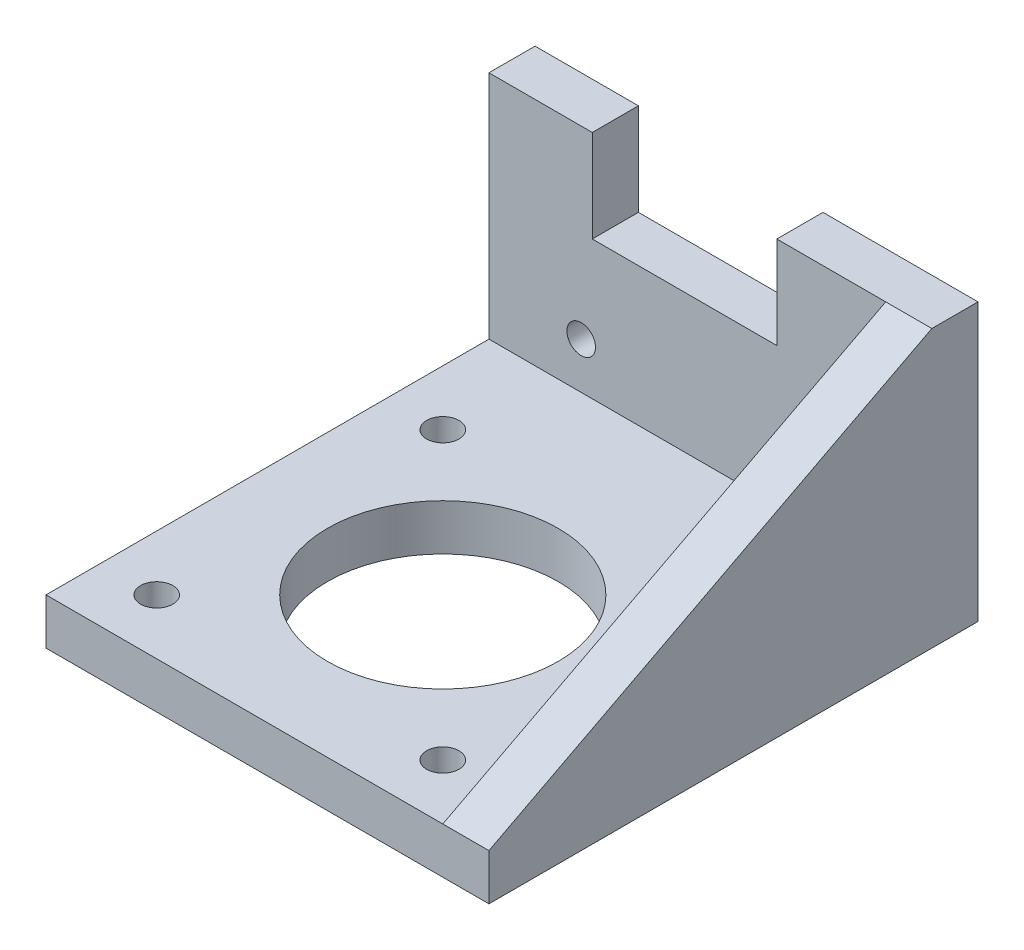
from build123d import *

# Parameters (mm, degrees)
SKETCH_1_W          = 43
SKETCH_1_H          = 43
SKETCH_1_R          = 1.75
SKETCH_1_R_2        = 12.5
EXTRUDE_1_DEPTH     = 5
SKETCH_3_W          = 43
SKETCH_3_H          = 5
EXTRUDE_2_DEPTH     = 5
SKETCH_4_W          = 43
SKETCH_4_H          = 30
EXTRUDE_3_DEPTH     = 5
SKETCH_5_R          = 1.55
CUT_EXTRUDE_1_DEPTH = 68.028261499
EXTRUDE_4_DEPTH     = 5
SKETCH_7_W          = 20
SKETCH_7_H          = 5
CUT_EXTRUDE_2_DEPTH = 10


with BuildPart() as part:
    # 草图1 → 凸台-拉伸1 (new body)
    with BuildSketch(Plane(origin=(0, 0, 0), x_dir=(1, 0, 0), z_dir=(0, 1, 0))):
        with Locations((-14.399691358, 11.712191358)):
            Rectangle(SKETCH_1_W, SKETCH_1_H)
        with Locations(Location((1.100308642, 27.212191358, 0), (0, 0, 270))):
            Circle(SKETCH_1_R, mode=Mode.SUBTRACT)
        with Locations(Location((-29.899691358, 27.212191358, 0), (0, 0, 270))):
            Circle(SKETCH_1_R, mode=Mode.SUBTRACT)
        with Locations(Location((-29.899691358, -3.787808642, 0), (0, 0, 270))):
            Circle(SKETCH_1_R, mode=Mode.SUBTRACT)
        with Locations(Location((1.100308642, -3.787808642, 0), (0, 0, 270))):
            Circle(SKETCH_1_R, mode=Mode.SUBTRACT)
        with Locations(Location((-14.399691358, 11.712191358, 0), (0, 0, 270))):
            Circle(SKETCH_1_R_2, mode=Mode.SUBTRACT)
    extrude(amount=EXTRUDE_1_DEPTH)

    # 草图3 → 凸台-拉伸2 (add)
    with BuildSketch(Plane(origin=(0, 0, -33.212191358), x_dir=(-1, 0, 0), z_dir=(0, 0, -1))):
        with Locations((14.399691358, 2.5)):
            Rectangle(SKETCH_3_W, SKETCH_3_H)
    extrude(amount=EXTRUDE_2_DEPTH)

    # 草图4 → 凸台-拉伸3 (add)
    with BuildSketch(Plane(origin=(0, 0, -38.212191358), x_dir=(-1, 0, 0), z_dir=(0, 0, -1))):
        with Locations((14.399691358, 15)):
            Rectangle(SKETCH_4_W, SKETCH_4_H)
    extrude(amount=EXTRUDE_3_DEPTH)

    # 草图5 → 切除-拉伸1 (cut, through all)
    with BuildSketch(Plane.XY.offset(-38.212191358)):
        with Locations((-0.899691358, 10)):
            Circle(SKETCH_5_R)
        with Locations((-25.899691358, 10)):
            Circle(SKETCH_5_R)
    extrude(amount=-CUT_EXTRUDE_1_DEPTH, mode=Mode.SUBTRACT)

    # 草图6 → 凸台-拉伸4 (add)
    with BuildSketch(Plane(origin=(7.100308642, 0, 0), x_dir=(0, 0, -1), z_dir=(1, 0, 0))):
        Polygon((-9.787808642, 0), (-9.787808642, 5), (38.212191358, 30), (43.212191358, 30), (43.212191358, 0), align=None)
    extrude(amount=EXTRUDE_4_DEPTH)

    # 草图7 → 切除-拉伸2 (cut)
    with BuildSketch(Plane(origin=(0, 30, 0), x_dir=(1, 0, 0), z_dir=(0, 1, 0))):
        with Locations((-14.699691358, 40.712191358)):
            Rectangle(SKETCH_7_W, SKETCH_7_H)
    extrude(amount=-CUT_EXTRUDE_2_DEPTH, mode=Mode.SUBTRACT)


solid = part.part
